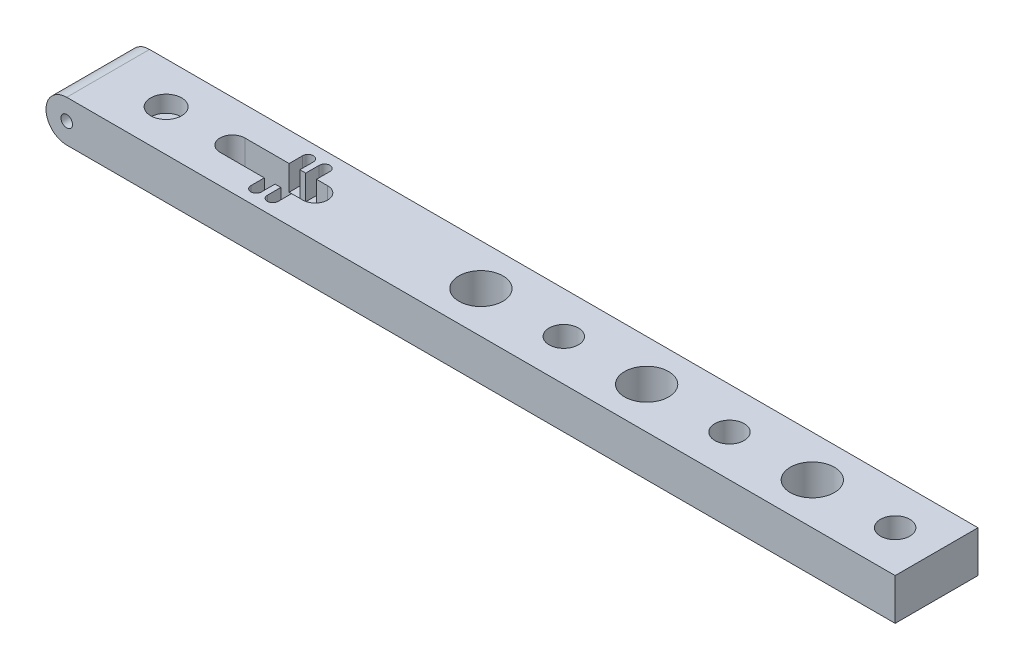
from build123d import *

# Parameters (mm, degrees)
BOSS_EXTRUDE1_DEPTH       = 12.7
F_2_56_TAPPED_HOLE1_D     = 1.778
F_2_56_TAPPED_HOLE1_DEPTH = 3.175
F_2_56_TAPPED_HOLE1_TIP   = 0.53416509
CUT_EXTRUDE1_DEPTH        = 128.791284914
CUT_EXTRUDE2_DEPTH        = 3.81
F_2_56_TAPPED_HOLE2_D     = 1.778
F_8_CLEARANCE_HOLE1_D     = 4.4958
F_1_4_CLEARANCE_HOLE1_D   = 6.7564
LPATTERN1_COUNT           = 3
LPATTERN1_PITCH           = 25.4
SKETCH11_R                = 2.38125
CUT_EXTRUDE3_DEPTH        = 2.54


with BuildPart() as part:
    # Sketch1 → Boss-Extrude1 (new body)
    with BuildSketch(Plane.XY):
        with BuildLine():
            Line((0, 0), (127, 0))
            Line((127, 0), (127, 6.35))
            Line((127, 6.35), (0, 6.35))
            ThreePointArc((0, 6.35), (-3.175, 3.175), (0, 0))
        make_face()
    extrude(amount=BOSS_EXTRUDE1_DEPTH)

    # #2-56 Tapped Hole1
    with Locations(Plane(origin=(0, 3.175, 12.7), x_dir=(1, 0, 0), z_dir=(0, 0, 1))):
        with Locations((0, 0)):
            Hole(F_2_56_TAPPED_HOLE1_D / 2, depth=F_2_56_TAPPED_HOLE1_DEPTH)
            with Locations((0, 0, -(F_2_56_TAPPED_HOLE1_DEPTH + F_2_56_TAPPED_HOLE1_TIP / 2))):  # 118° drill point
                Cone(0, F_2_56_TAPPED_HOLE1_D / 2, F_2_56_TAPPED_HOLE1_TIP, mode=Mode.SUBTRACT)

    # Sketch6 → Cut-Extrude1 (cut, through all)
    with BuildSketch(Plane(origin=(0, 6.35, 0), x_dir=(1, 0, 0), z_dir=(0, 1, 0))):
        with BuildLine():
            Line((19.05, -4.445), (31.75, -4.445))
            ThreePointArc((31.75, -4.445), (33.655, -6.35), (31.75, -8.255))
            Line((31.75, -8.255), (19.05, -8.255))
            ThreePointArc((19.05, -8.255), (17.145, -6.35), (19.05, -4.445))
        make_face()
    extrude(amount=-CUT_EXTRUDE1_DEPTH, mode=Mode.SUBTRACT)

    # Sketch7 → Cut-Extrude2 (cut)
    with BuildSketch(Plane(origin=(0, 6.35, 0), x_dir=(1, 0, 0), z_dir=(0, 1, 0))):
        with BuildLine():
            Line((28.3845, -10.31875), (28.3845, -2.38125))
            ThreePointArc((28.3845, -2.38125), (29.21, -1.55575), (30.0355, -2.38125))
            Line((30.0355, -2.38125), (30.0355, -10.31875))
            ThreePointArc((30.0355, -10.31875), (29.21, -11.14425), (28.3845, -10.31875))
        make_face()
        with BuildLine():
            Line((25.8445, -10.31875), (25.8445, -2.38125))
            ThreePointArc((25.8445, -2.38125), (26.67, -1.55575), (27.4955, -2.38125))
            Line((27.4955, -2.38125), (27.4955, -10.31875))
            ThreePointArc((27.4955, -10.31875), (26.67, -11.14425), (25.8445, -10.31875))
        make_face()
    extrude(amount=-CUT_EXTRUDE2_DEPTH, mode=Mode.SUBTRACT)

    # #2-56 Tapped Hole2 (through all)
    with Locations(Plane(origin=(8.89, 6.35, 6.35), x_dir=(0, 0, 1), z_dir=(0, 1, 0))):
        with Locations((0, 0)):
            Hole(F_2_56_TAPPED_HOLE2_D / 2)

    # #8 Clearance Hole1 (through all)
    with Locations(Plane(origin=(120.65, 6.35, 6.35), x_dir=(0, 0, 1), z_dir=(0, 1, 0))):
        with Locations((0, 0)):
            f_8_clearance_hole1 = Hole(F_8_CLEARANCE_HOLE1_D / 2)

    # 1/4 Clearance Hole1 (through all)
    with Locations(Plane(origin=(107.95, 6.35, 6.35), x_dir=(0, 0, 1), z_dir=(0, 1, 0))):
        with Locations((0, 0)):
            f_1_4_clearance_hole1 = Hole(F_1_4_CLEARANCE_HOLE1_D / 2)

    # LPattern1: #8 Clearance Hole1, 1/4 Clearance Hole1 ×3
    with Locations(*[(-i * LPATTERN1_PITCH, 0, 0) for i in range(1, LPATTERN1_COUNT)]):
        add(f_8_clearance_hole1, mode=Mode.SUBTRACT)
        add(f_1_4_clearance_hole1, mode=Mode.SUBTRACT)

    # Sketch11 → Cut-Extrude3 (cut)
    with BuildSketch(Plane(origin=(0, 6.35, 0), x_dir=(1, 0, 0), z_dir=(0, 1, 0))):
        with Locations(Location((8.89, -6.35, 0), (0, 0, 270))):
            Circle(SKETCH11_R)
    extrude(amount=-CUT_EXTRUDE3_DEPTH, mode=Mode.SUBTRACT)


solid = part.part
